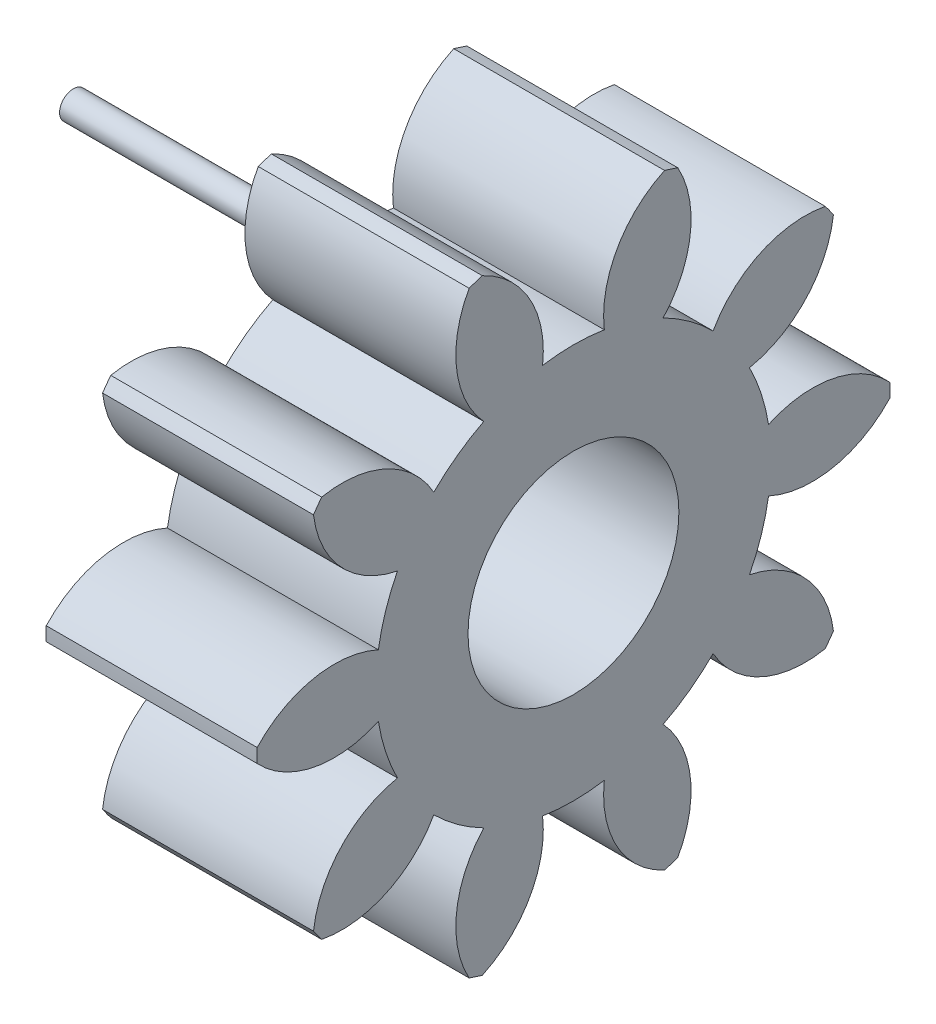
from build123d import *

# Parameters (mm, degrees)
BASPROSKE_W     = 1
BASPROSKE_H     = 1.5
TOOTHCUT_DEPTH  = 3.34520788
TEETHCUTS_COUNT = 10
TEETHCUTS_ANGLE = 324
BORSKE_R        = 0.5
BORE_DEPTH      = 50.0000508
SKETCH_1_R      = 0.065
EXTRUDE_2_DEPTH = 2


with BuildPart() as part:
    # BasProSke → Base-Revolve (revolve)
    with BuildSketch(Plane(origin=(0, 0, 0), x_dir=(1, 0, 0), z_dir=(0, 1, 0)), mode=Mode.PRIVATE) as base_revolve_sk:
        with Locations((0.5, 0.75)):
            Rectangle(BASPROSKE_W, BASPROSKE_H)
    revolve(base_revolve_sk.sketch.rotate(Axis((-10, 0, 0), (1, 0, 0)), 180), axis=Axis((-10, 0, 0), (1, 0, 0)))

    # TooCutSke → ToothCut (cut, through all)
    with BuildSketch(Plane(origin=(0, 0, 0), x_dir=(0, 0, -1), z_dir=(1, 0, 0))):
        with BuildLine():
            ThreePointArc((0.146321185, 0.924998573), (0, 0.9365), (-0.146321185, 0.924998573))
            ThreePointArc((-0.146321185, 0.924998573), (-0.216454601, 1.244005636), (-0.468585949, 1.451644712))
            ThreePointArc((-0.468585949, 1.451644712), (0, 1.5254), (0.468585949, 1.451644712))
            ThreePointArc((0.468585949, 1.451644712), (0.216454601, 1.244005636), (0.146321185, 0.924998573))
        make_face()
    toothcut = extrude(amount=TOOTHCUT_DEPTH, mode=Mode.SUBTRACT)

    # TeethCuts: ToothCut ×10 about axis
    teethcuts_axis = Axis((-10, 0, 0), (1, 0, 0))
    for i in range(1, TEETHCUTS_COUNT):
        add(toothcut.rotate(teethcuts_axis, i * TEETHCUTS_ANGLE / (TEETHCUTS_COUNT - 1)), mode=Mode.SUBTRACT)

    # BorSke → Bore (cut, symmetric)
    with BuildSketch(Plane(origin=(0, 0, 0), x_dir=(0, 0, -1), z_dir=(1, 0, 0))):
        with Locations(Location((0, 0, 0), (0, 0, 180))):
            Circle(BORSKE_R)
    extrude(amount=BORE_DEPTH, both=True, mode=Mode.SUBTRACT)

    # 草圖1 → 填料-伸長2 (add)
    with BuildSketch(Plane(origin=(1, 0, 0), x_dir=(0, 0, -1), z_dir=(1, 0, 0))):
        with Locations((-0.371432866, 1.108307745)):
            Circle(SKETCH_1_R)
    extrude(amount=-EXTRUDE_2_DEPTH)


solid = part.part
